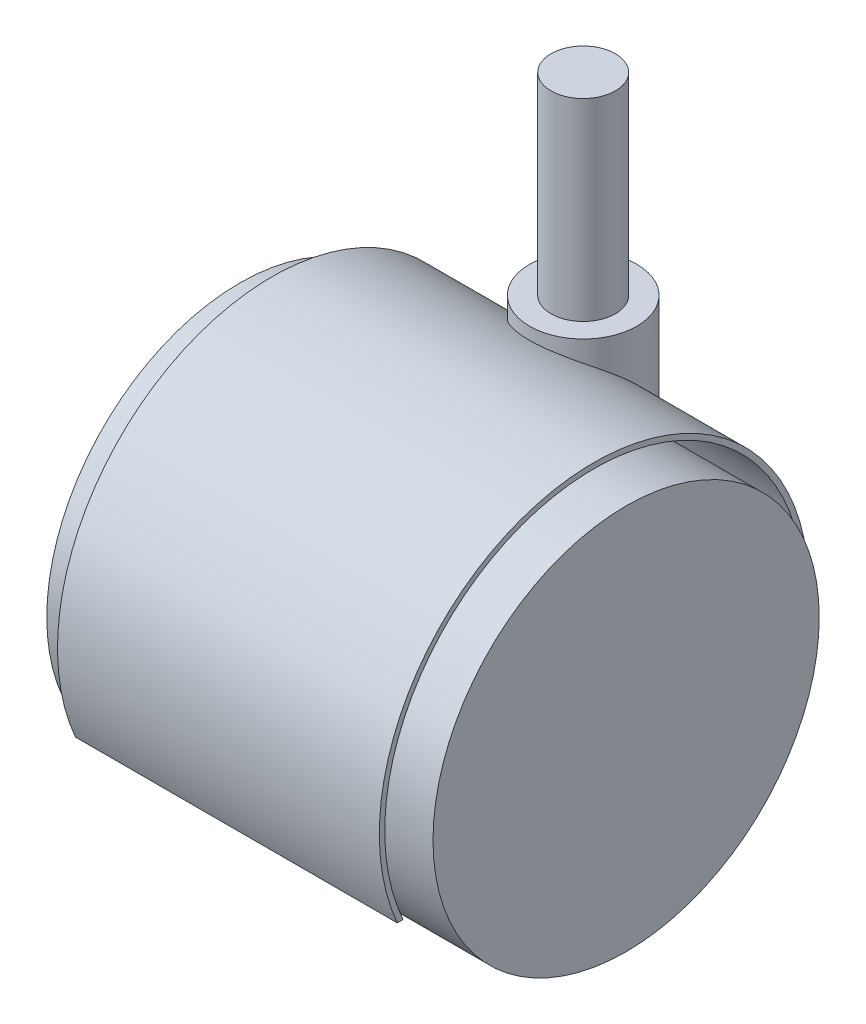
from build123d import *

# Parameters (mm, degrees)
BASE_ROUE_DEPTH         = 15
ESQUISSE2_R             = 19.5
VIDE_ROUE_DEPTH         = 13
ESQUISSE3_R             = 4.5
AXE_ROUE_DEPTH          = 5
ESQUISSE4_R             = 18
ROUE_DEPTH              = 11
ESQUISSE6_R             = 5
VIS_DEPTH               = 32
ENL_V_START             = -18
ESQUISSE7_R             = 5
ESQUISSE7_R_2           = 3
ENL_V_MAT_EXTRU_3_DEPTH = 18


with BuildPart() as part:
    # Esquisse1 → BASE ROUE (new body)
    with BuildSketch(Plane(origin=(0, 0, 0), x_dir=(0, 0, -1), z_dir=(1, 0, 0))):
        with BuildLine():
            Line((-18.33030278, -8), (18.33030278, -8))
            ThreePointArc((18.33030278, -8), (0, 20), (-18.33030278, -8))
        make_face()
    base_roue = extrude(amount=BASE_ROUE_DEPTH)

    # Esquisse2 → VIDE ROUE (cut)
    with BuildSketch(Plane(origin=(15, 0, 0), x_dir=(0, 0, -1), z_dir=(1, 0, 0))):
        Circle(ESQUISSE2_R)
    vide_roue = extrude(amount=-VIDE_ROUE_DEPTH, mode=Mode.SUBTRACT)

    # Esquisse3 → AXE ROUE (add)
    with BuildSketch(Plane(origin=(2, 0, 0), x_dir=(0, 0, -1), z_dir=(1, 0, 0))):
        Circle(ESQUISSE3_R)
    axe_roue = extrude(amount=AXE_ROUE_DEPTH)

    # Esquisse4 → ROUE (add)
    with BuildSketch(Plane(origin=(7, 0, 0), x_dir=(0, 0, -1), z_dir=(1, 0, 0))):
        Circle(ESQUISSE4_R)
    roue = extrude(amount=ROUE_DEPTH)

    # SYM ROUE + BASE: BASE ROUE, VIDE ROUE, AXE ROUE, ROUE across plane
    add(base_roue.mirror(Plane(origin=(0, 0, 0), x_dir=(0, 0, 1), z_dir=(1, 0, 0))))
    add(vide_roue.mirror(Plane(origin=(0, 0, 0), x_dir=(0, 0, 1), z_dir=(1, 0, 0))), mode=Mode.SUBTRACT)
    add(axe_roue.mirror(Plane(origin=(0, 0, 0), x_dir=(0, 0, 1), z_dir=(1, 0, 0))))
    add(roue.mirror(Plane(origin=(0, 0, 0), x_dir=(0, 0, 1), z_dir=(1, 0, 0))))

    # Esquisse6 → VIS (add)
    with BuildSketch(Plane(origin=(0, 5, 0), x_dir=(1, 0, 0), z_dir=(0, 1, 0))):
        with Locations(Location((0, 14, 0), (0, 0, 90))):
            Circle(ESQUISSE6_R)
    extrude(amount=VIS_DEPTH)

    # Esquisse7 → Enlèv. mat.-Extru.3 (cut)
    with BuildSketch(Plane(origin=(0, 37, 0), x_dir=(1, 0, 0), z_dir=(0, 1, 0)).offset(ENL_V_START)):
        with Locations(Location((0, 14, 0), (0, 0, 90))):
            Circle(ESQUISSE7_R)
        with Locations(Location((0, 14, 0), (0, 0, 270))):
            Circle(ESQUISSE7_R_2, mode=Mode.SUBTRACT)
    extrude(amount=ENL_V_MAT_EXTRU_3_DEPTH, mode=Mode.SUBTRACT)


solid = part.part
